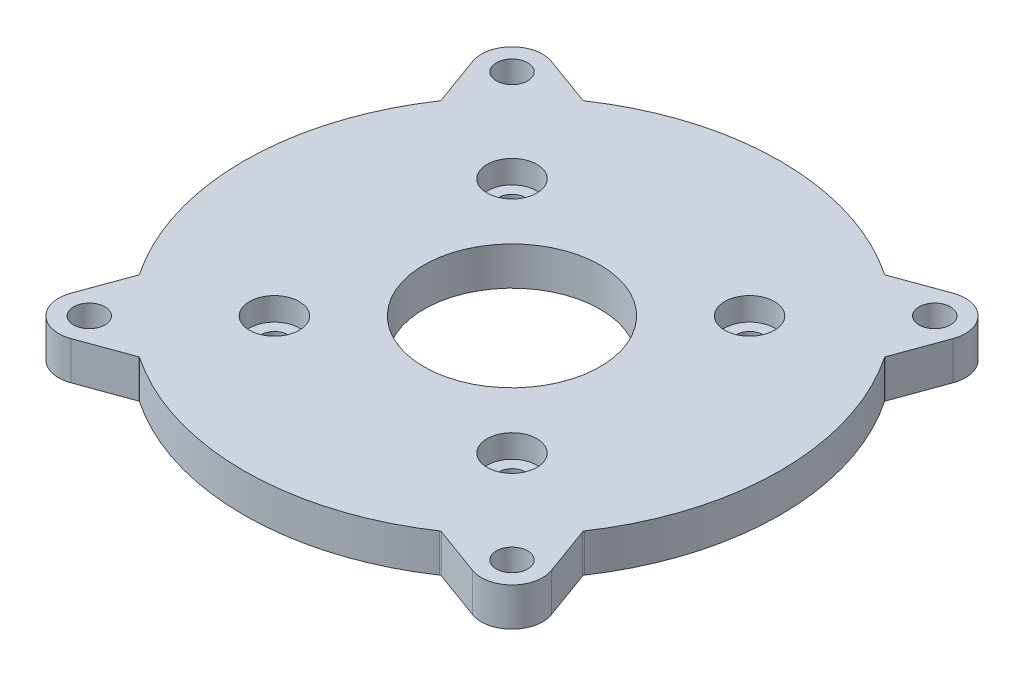
from build123d import *

# Parameters (mm, degrees)
SKETCH1_R                = 35
BOSS_EXTRUDE1_DEPTH      = 5
SKETCH2_R                = 11.5
CUT_EXTRUDE1_DEPTH       = 50.749371855
SKETCH2_4_R              = 3.25
SKETCH2_4_R_2            = 1.75
CUT_EXTRUDE2_DEPTH       = 3
SKETCH2_5_R              = 1.75
CUT_EXTRUDE3_DEPTH       = 50.749371855
CIRPATTERN3_COUNT        = 4
BOSS_EXTRUDE2_START      = -5
SKETCH3_R                = 2.05
BOSS_EXTRUDE2_DEPTH      = 5
FILLET1_R                = 0.2
CIRPATTERN4_COUNT        = 4
FILLET1_OF_CIRPATTERN4_R = 0.2


with BuildPart() as part:
    # Sketch1 → Boss-Extrude1 (new body)
    with BuildSketch(Plane(origin=(0, 0, 0), x_dir=(1, 0, 0), z_dir=(0, 1, 0))):
        with Locations(Location((0, 0, 0), (0, 0, 270))):
            Circle(SKETCH1_R)
    extrude(amount=BOSS_EXTRUDE1_DEPTH)

    # Sketch2 → Cut-Extrude1 (cut, through all)
    with BuildSketch(Plane(origin=(0, 5, 0), x_dir=(1, 0, 0), z_dir=(0, 1, 0))):
        with Locations(Location((0, 0, 0), (0, 0, 270))):
            Circle(SKETCH2_R)
    extrude(amount=-CUT_EXTRUDE1_DEPTH, mode=Mode.SUBTRACT)

    # Sketch2<4> → Cut-Extrude2 (cut)
    with BuildSketch(Plane(origin=(0, 5, 0), x_dir=(1, 0, 0), z_dir=(0, 1, 0))):
        with Locations(Location((15.499780644, 15.499780644, 0), (0, 0, 270))):
            Circle(SKETCH2_4_R)
        with Locations(Location((15.499780644, 15.499780644, 0), (0, 0, 270))):
            Circle(SKETCH2_4_R_2, mode=Mode.SUBTRACT)
    cut_extrude2 = extrude(amount=-CUT_EXTRUDE2_DEPTH, mode=Mode.SUBTRACT)

    # Sketch2<5> → Cut-Extrude3 (cut, through all)
    with BuildSketch(Plane(origin=(0, 5, 0), x_dir=(1, 0, 0), z_dir=(0, 1, 0))):
        with Locations(Location((15.499780644, 15.499780644, 0), (0, 0, 270))):
            Circle(SKETCH2_5_R)
    cut_extrude3 = extrude(amount=-CUT_EXTRUDE3_DEPTH, mode=Mode.SUBTRACT)

    # CirPattern3: Cut-Extrude2, Cut-Extrude3 ×4 about axis
    cirpattern3_axis = Axis((0, 0, 0), (0, 1, 0))
    add([cut_extrude2.rotate(cirpattern3_axis, i * 360 / CIRPATTERN3_COUNT) for i in range(1, CIRPATTERN3_COUNT)], mode=Mode.SUBTRACT)
    add([cut_extrude3.rotate(cirpattern3_axis, i * 360 / CIRPATTERN3_COUNT) for i in range(1, CIRPATTERN3_COUNT)], mode=Mode.SUBTRACT)

    # Sketch3 → Boss-Extrude2 (add)
    with BuildSketch(Plane(origin=(0, 5, 0), x_dir=(1, 0, 0), z_dir=(0, 1, 0)).offset(BOSS_EXTRUDE2_START)):
        with BuildLine():
            ThreePointArc((19.664153078, 28.953774948), (24.748737342, 24.748737342), (28.953774948, 19.664153078))
            Line((28.953774948, 19.664153078), (31.335934949, 26.209083893))
            ThreePointArc((31.335934949, 26.209083893), (30.405591591, 30.405591591), (26.209083893, 31.335934949))
            Line((26.209083893, 31.335934949), (19.664153078, 28.953774948))
        make_face()
        with Locations(Location((27.577164466, 27.577164466, 0), (0, 0, 270))):
            Circle(SKETCH3_R, mode=Mode.SUBTRACT)
    boss_extrude2 = extrude(amount=BOSS_EXTRUDE2_DEPTH)

    # Fillet1
    fillet1_edges = [part.edges().sort_by_distance(p)[0] for p in [
        (19.664153078, 2.5, -28.953774948),
        (28.953774948, 2.5, -19.664153078),
    ]]
    fillet(fillet1_edges, radius=FILLET1_R)

    # CirPattern4: Boss-Extrude2 ×4 about axis
    cirpattern4_axis = Axis((0, 0, 0), (0, 1, 0))
    for i in range(1, CIRPATTERN4_COUNT):
        add(boss_extrude2.rotate(cirpattern4_axis, i * 360 / CIRPATTERN4_COUNT))

    # Fillet1 of CirPattern4
    fillet1_of_cirpattern4_edges = [part.edges().sort_by_distance(p)[0] for p in [
        (-28.953774948, 2.5, -19.664153078),
        (-19.664153078, 2.5, -28.953774948),
        (-19.664153078, 2.5, 28.953774948),
        (-28.953774948, 2.5, 19.664153078),
        (28.953774948, 2.5, 19.664153078),
        (19.664153078, 2.5, 28.953774948),
    ]]
    fillet(fillet1_of_cirpattern4_edges, radius=FILLET1_OF_CIRPATTERN4_R)


solid = part.part
